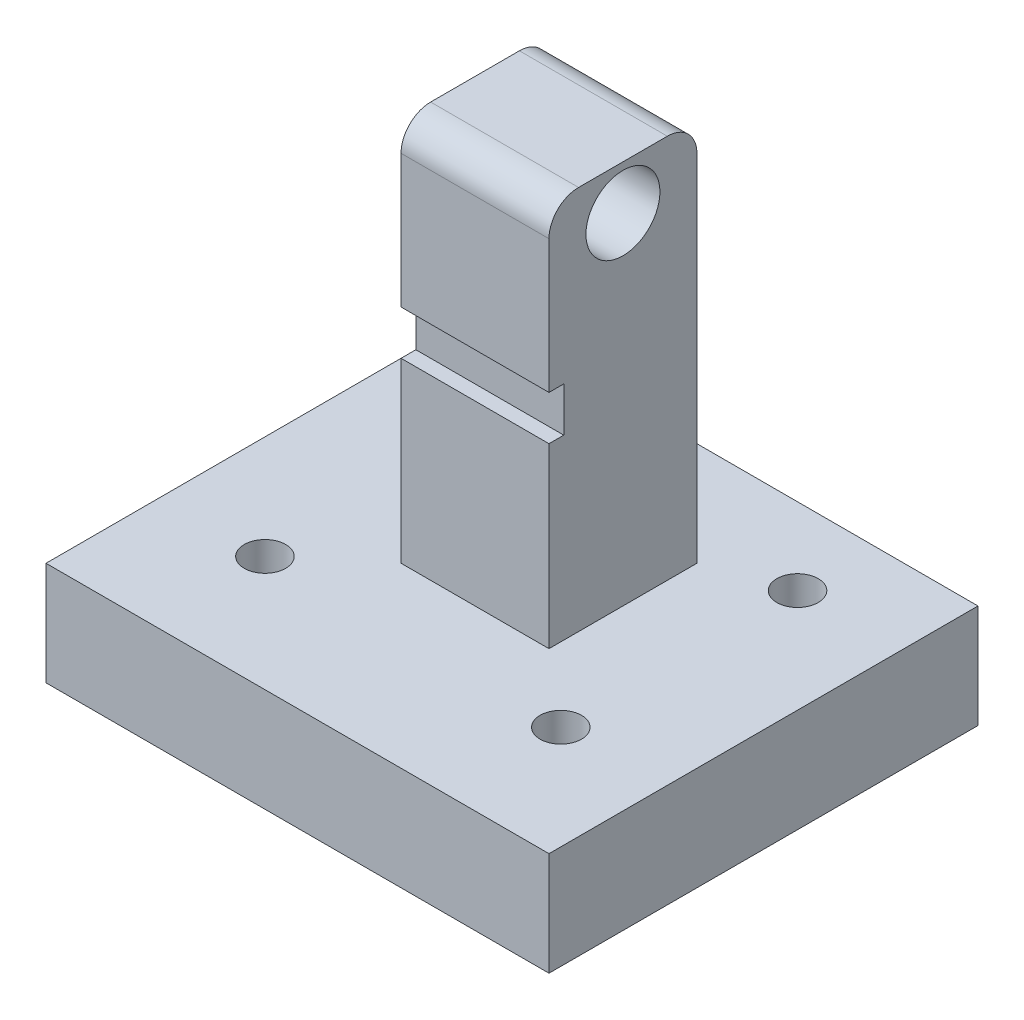
from build123d import *

# Parameters (mm, degrees)
SKETCH2_W               = 147.5
SKETCH2_H               = 176.75
BOSS_EXTRUDE1_DEPTH     = 10
SKETCH3_W               = 29
SKETCH3_H               = 15
BOSS_EXTRUDE2_DEPTH     = 34
BOSS_EXTRUDE3_DEPTH     = 34
SKETCH8_W               = 113.5
SKETCH8_H               = 176.75
CUT_EXTRUDE1_DEPTH      = 30
SKETCH9_R               = 2.5
CUT_EXTRUDE2_DEPTH      = 134.016415209
SKETCH10_W              = 3
SKETCH10_H              = 3
CUT_EXTRUDE3_DEPTH      = 3
CUT_EXTRUDE4_DEPTH      = 134.016415209
CUT_EXTRUDE4_DEPTH_BACK = 134.016415209
SKETCH11_W              = 9
SKETCH11_H              = 8
SKETCH11_H_2            = 4
SKETCH11_W_2            = 3
SKETCH11_R              = 2.5
SKETCH11_W_3            = 34
SKETCH11_H_3            = 15
CUT_EXTRUDE5_DEPTH      = 94.691731892
CUT_EXTRUDE5_DEPTH_BACK = 94.691731892
SKETCH13_R              = 2.5
CUT_EXTRUDE6_DEPTH      = 94.691731892
CUT_EXTRUDE6_DEPTH_BACK = 94.691731892
SKETCH14_W              = 10
SKETCH14_H              = 2
FILLET1_R               = 2
SKETCH15_R              = 1.4
CUT_EXTRUDE7_DEPTH      = 34
SKETCH18_W              = 12
SKETCH18_H              = 8
CUT_EXTRUDE8_DEPTH      = 34
SKETCH19_W              = 7
SKETCH19_H              = 8
SKETCH19_W_2            = 12
CUT_EXTRUDE9_DEPTH      = 34
BOSS_EXTRUDE4_START     = 5
SKETCH20_W              = 34
SKETCH20_H              = 29
SKETCH20_R              = 1.4
BOSS_EXTRUDE4_DEPTH     = 5
SKETCH21_W              = 34
SKETCH21_H              = 29
SKETCH21_W_2            = 10
SKETCH21_H_2            = 10
CUT_EXTRUDE10_DEPTH     = 5
SKETCH22_W              = 10
SKETCH22_H              = 3
CUT_EXTRUDE11_DEPTH     = 1


with BuildPart() as part:
    # Sketch2 → Boss-Extrude1 (new body)
    with BuildSketch(Plane.XY):
        Rectangle(SKETCH2_W, SKETCH2_H)
    extrude(amount=BOSS_EXTRUDE1_DEPTH)

    # Sketch3 → Boss-Extrude2 (add)
    with BuildSketch(Plane.ZY.offset(73.75)):
        with Locations((7.5, 80.875)):
            Rectangle(SKETCH3_W, SKETCH3_H)
        with Locations((7.5, -80.875)):
            Rectangle(SKETCH3_W, SKETCH3_H)
    boss_extrude2 = extrude(amount=-BOSS_EXTRUDE2_DEPTH)

    # Mirror1: Boss-Extrude2 across plane
    add(boss_extrude2.mirror(Plane(origin=(0, 0, 0), x_dir=(0, 0, 1), z_dir=(1, 0, 0))))

    # Sketch5 → Boss-Extrude3 (add)
    with BuildSketch(Plane.ZY.offset(73.75)):
        Polygon((13.717233978, 0), (47.494362324, 23.650999887), (54.37727956, 13.821175356), (66.664560225, 22.424821901), (50.030843571, 46.180231185), (37.743562906, 37.57658464), (41.758597961, 31.84252033), (10, 9.604910635), (10, -9.604910635), (41.758597961, -31.84252033), (37.743562906, -37.57658464), (50.030843571, -46.180231185), (66.664560225, -22.424821901), (54.37727956, -13.821175356), (47.494362324, -23.650999887), align=None)
    extrude(amount=-BOSS_EXTRUDE3_DEPTH)

    # Sketch8 → Cut-Extrude1 (cut)
    with BuildSketch(Plane.XY.offset(22)):
        with Locations((17, 0)):
            Rectangle(SKETCH8_W, SKETCH8_H)
    extrude(amount=-CUT_EXTRUDE1_DEPTH, mode=Mode.SUBTRACT)

    # Sketch9 → Cut-Extrude2 (cut, through all)
    with BuildSketch(Plane(origin=(0, 0, 0), x_dir=(-1, 0, 0), z_dir=(0, 0, -1))):
        with Locations((49.75, 58.375)):
            Circle(SKETCH9_R)
        with Locations((63.75, 58.375)):
            Circle(SKETCH9_R)
        with Locations((49.75, -53.375)):
            Circle(SKETCH9_R)
        with Locations((63.75, -53.375)):
            Circle(SKETCH9_R)
    extrude(amount=-CUT_EXTRUDE2_DEPTH, mode=Mode.SUBTRACT)

    # Sketch10 → Cut-Extrude3 (cut)
    with BuildSketch(Plane(origin=(0, 0, -7), x_dir=(-1, 0, 0), z_dir=(0, 0, -1))):
        with Locations((72.25, 86.875)):
            Rectangle(SKETCH10_W, SKETCH10_H)
    extrude(amount=-CUT_EXTRUDE3_DEPTH, mode=Mode.SUBTRACT)

    # Sketch11 → Cut-Extrude4 (cut, two sides: drawn at the far end of the back side and taken through both)
    # profile 1 of 12: a face of its own
    with BuildSketch(Plane(origin=(0, 0, 0), x_dir=(-1, 0, 0), z_dir=(0, 0, -1)).offset(-CUT_EXTRUDE4_DEPTH_BACK)):
        with Locations((47.25, -69.375)):
            Rectangle(SKETCH11_W, SKETCH11_H)
    # profile 2 of 12: a face of its own
    with BuildSketch(Plane(origin=(0, 0, 0), x_dir=(-1, 0, 0), z_dir=(0, 0, -1)).offset(-CUT_EXTRUDE4_DEPTH_BACK)):
        with Locations((47.25, -63.375)):
            Rectangle(SKETCH11_W, SKETCH11_H_2)
    # profile 3 of 12: a face of its own
    with BuildSketch(Plane(origin=(0, 0, 0), x_dir=(-1, 0, 0), z_dir=(0, 0, -1)).offset(-CUT_EXTRUDE4_DEPTH_BACK)):
        with Locations((41.25, -69.375)):
            Rectangle(SKETCH11_W_2, SKETCH11_H)
    # profile 4 of 12: a face of its own
    with BuildSketch(Plane(origin=(0, 0, 0), x_dir=(-1, 0, 0), z_dir=(0, 0, -1)).offset(-CUT_EXTRUDE4_DEPTH_BACK)):
        with Locations((41.25, -63.375)):
            Rectangle(SKETCH11_W_2, SKETCH11_H_2)
    # profile 5 of 12: a face of its own
    with BuildSketch(Plane(origin=(0, 0, 0), x_dir=(-1, 0, 0), z_dir=(0, 0, -1)).offset(-CUT_EXTRUDE4_DEPTH_BACK)):
        with Locations((66.25, -69.375)):
            Rectangle(SKETCH11_W, SKETCH11_H)
    # profile 6 of 12: a face of its own
    with BuildSketch(Plane(origin=(0, 0, 0), x_dir=(-1, 0, 0), z_dir=(0, 0, -1)).offset(-CUT_EXTRUDE4_DEPTH_BACK)):
        with Locations((66.25, -63.375)):
            Rectangle(SKETCH11_W, SKETCH11_H_2)
    # profile 7 of 12: a face of its own
    with BuildSketch(Plane(origin=(0, 0, 0), x_dir=(-1, 0, 0), z_dir=(0, 0, -1)).offset(-CUT_EXTRUDE4_DEPTH_BACK)):
        with Locations((72.25, -63.375)):
            Rectangle(SKETCH11_W_2, SKETCH11_H_2)
    # profile 8 of 12: a face of its own
    with BuildSketch(Plane(origin=(0, 0, 0), x_dir=(-1, 0, 0), z_dir=(0, 0, -1)).offset(-CUT_EXTRUDE4_DEPTH_BACK)):
        with Locations((72.25, -69.375)):
            Rectangle(SKETCH11_W_2, SKETCH11_H)
    # profile 9 of 12: a face of its own
    with BuildSketch(Plane(origin=(0, 0, 0), x_dir=(-1, 0, 0), z_dir=(0, 0, -1)).offset(-CUT_EXTRUDE4_DEPTH_BACK)):
        Polygon((39.75, 73.375), (39.75, -58.375), (51.75, -58.375), (61.75, -58.375), (73.75, -58.375), (73.75, 73.375), align=None)
        with Locations((49.75, -53.375)):
            Circle(SKETCH11_R, mode=Mode.SUBTRACT)
        with Locations((63.75, -53.375)):
            Circle(SKETCH11_R, mode=Mode.SUBTRACT)
        with Locations((49.75, 58.375)):
            Circle(SKETCH11_R, mode=Mode.SUBTRACT)
        with Locations((63.75, 58.375)):
            Circle(SKETCH11_R, mode=Mode.SUBTRACT)
    # profile 10 of 12: a face of its own
    with BuildSketch(Plane(origin=(0, 0, 0), x_dir=(-1, 0, 0), z_dir=(0, 0, -1)).offset(-CUT_EXTRUDE4_DEPTH_BACK)):
        Polygon((61.75, -58.375), (61.75, -61.375), (70.75, -61.375), (73.75, -61.375), (73.75, -58.375), align=None)
    # profile 11 of 12: a face of its own
    with BuildSketch(Plane(origin=(0, 0, 0), x_dir=(-1, 0, 0), z_dir=(0, 0, -1)).offset(-CUT_EXTRUDE4_DEPTH_BACK)):
        Polygon((39.75, -58.375), (39.75, -61.375), (42.75, -61.375), (51.75, -61.375), (51.75, -58.375), align=None)
    # profile 12 of 12: a face of its own
    with BuildSketch(Plane(origin=(0, 0, 0), x_dir=(-1, 0, 0), z_dir=(0, 0, -1)).offset(-CUT_EXTRUDE4_DEPTH_BACK)):
        with Locations((56.75, 80.875)):
            Rectangle(SKETCH11_W_3, SKETCH11_H_3)
    extrude(amount=CUT_EXTRUDE4_DEPTH + CUT_EXTRUDE4_DEPTH_BACK, mode=Mode.SUBTRACT)

    # Sketch13 → Cut-Extrude5 (cut, two sides: drawn at the far end of the back side and taken through both)
    with BuildSketch(Plane.ZY.offset(61.75).offset(-CUT_EXTRUDE5_DEPTH_BACK)):
        with Locations((5, -63.375)):
            Circle(SKETCH13_R)
    extrude(amount=CUT_EXTRUDE5_DEPTH + CUT_EXTRUDE5_DEPTH_BACK, mode=Mode.SUBTRACT)

    # Sketch14 → Cut-Extrude6 (cut, two sides: drawn at the far end of the back side and taken through both)
    with BuildSketch(Plane.ZY.offset(61.75).offset(-CUT_EXTRUDE6_DEPTH_BACK)):
        with Locations((5, -59.375)):
            Rectangle(SKETCH14_W, SKETCH14_H)
    extrude(amount=CUT_EXTRUDE6_DEPTH + CUT_EXTRUDE6_DEPTH_BACK, mode=Mode.SUBTRACT)

    # Fillet1
    fillet1_edges = [part.edges().sort_by_distance(p)[0] for p in [
        (-56.75, -60.375, 0),
        (-56.75, -60.375, 10),
    ]]
    fillet(fillet1_edges, radius=FILLET1_R)

    # Sketch15 → Cut-Extrude7 (cut)
    with BuildSketch(Plane.XZ.offset(88.375)):
        with Locations(Location((-46.75, -1.8, 0), (0, 0, 270))):
            Circle(SKETCH15_R)
        with Locations(Location((-66.75, -1.8, 0), (0, 0, 270))):
            Circle(SKETCH15_R)
        with Locations(Location((-66.75, 14.2, 0), (0, 0, 270))):
            Circle(SKETCH15_R)
        with Locations(Location((-46.75, 14.2, 0), (0, 0, 270))):
            Circle(SKETCH15_R)
    extrude(amount=-CUT_EXTRUDE7_DEPTH, mode=Mode.SUBTRACT)

    # Sketch18 → Cut-Extrude8 (cut)
    with BuildSketch(Plane(origin=(0, 0, -7), x_dir=(-1, 0, 0), z_dir=(0, 0, -1))):
        with Locations((45.75, -77.375)):
            Rectangle(SKETCH18_W, SKETCH18_H)
        with Locations((67.75, -77.375)):
            Rectangle(SKETCH18_W, SKETCH18_H)
    extrude(amount=-CUT_EXTRUDE8_DEPTH, mode=Mode.SUBTRACT)

    # Sketch19 → Cut-Extrude9 (cut)
    with BuildSketch(Plane.ZY.offset(61.75)):
        with Locations((-3.5, -77.375)):
            Rectangle(SKETCH19_W, SKETCH19_H)
        with Locations((16, -77.375)):
            Rectangle(SKETCH19_W_2, SKETCH19_H)
    extrude(amount=-CUT_EXTRUDE9_DEPTH, mode=Mode.SUBTRACT)

    # Sketch20 → Boss-Extrude4 (add)
    with BuildSketch(Plane.XZ.offset(88.375).offset(BOSS_EXTRUDE4_START)):
        with Locations((-56.75, 7.5)):
            Rectangle(SKETCH20_W, SKETCH20_H)
        with Locations(Location((-66.75, 14.2, 0), (0, 0, 270))):
            Circle(SKETCH20_R, mode=Mode.SUBTRACT)
        with Locations(Location((-46.75, 14.2, 0), (0, 0, 270))):
            Circle(SKETCH20_R, mode=Mode.SUBTRACT)
        with Locations(Location((-46.75, -1.8, 0), (0, 0, 270))):
            Circle(SKETCH20_R, mode=Mode.SUBTRACT)
        with Locations(Location((-66.75, -1.8, 0), (0, 0, 270))):
            Circle(SKETCH20_R, mode=Mode.SUBTRACT)
    extrude(amount=-BOSS_EXTRUDE4_DEPTH)

    # Sketch21 → Cut-Extrude10 (cut)
    with BuildSketch(Plane(origin=(0, -81.375, 0), x_dir=(1, 0, 0), z_dir=(0, 1, 0))):
        with Locations((-56.75, -7.5)):
            Rectangle(SKETCH21_W, SKETCH21_H)
        with Locations((-56.75, -5)):
            Rectangle(SKETCH21_W_2, SKETCH21_H_2, mode=Mode.SUBTRACT)
    extrude(amount=-CUT_EXTRUDE10_DEPTH, mode=Mode.SUBTRACT)

    # Sketch22 → Cut-Extrude11 (cut)
    with BuildSketch(Plane.XY.offset(10)):
        with Locations((-56.75, -72.875)):
            Rectangle(SKETCH22_W, SKETCH22_H)
    extrude(amount=-CUT_EXTRUDE11_DEPTH, mode=Mode.SUBTRACT)


solid = part.part
